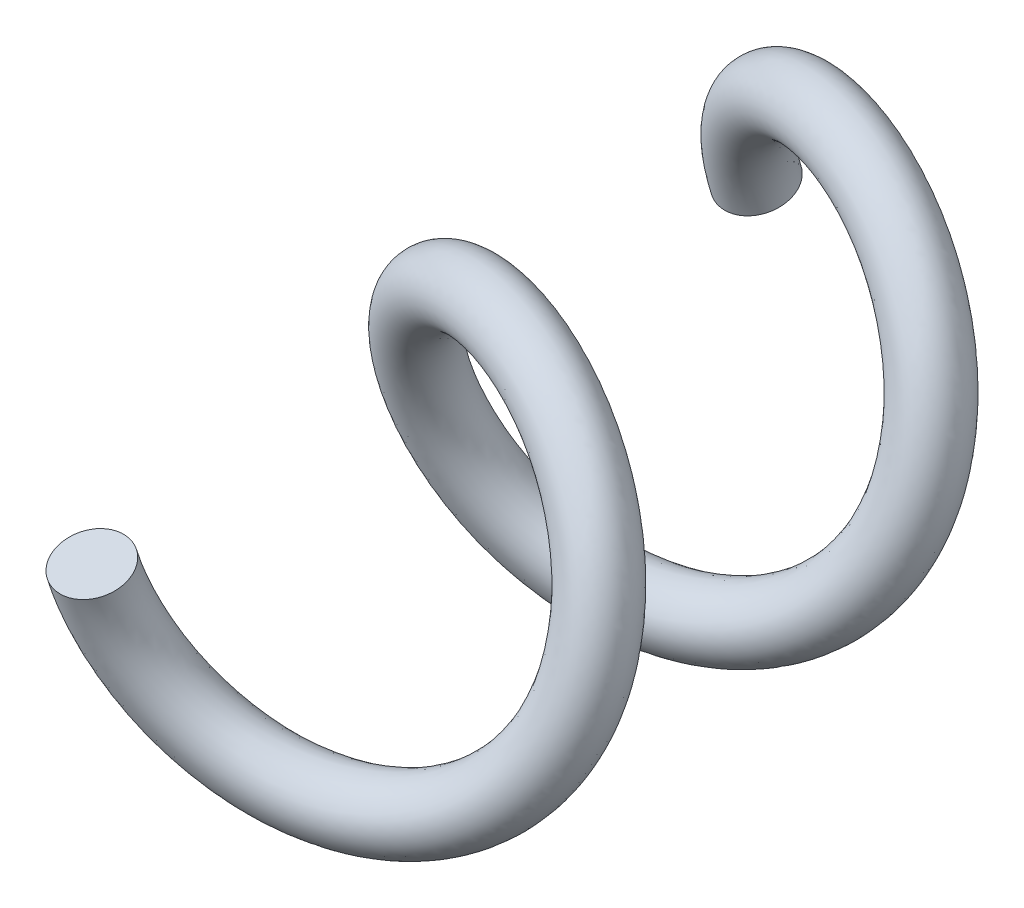
from build123d import *

# Parameters (mm, degrees)
SWEEP_2_PITCH       = 100
SWEEP_2_HEIGHT      = 200
SWEEP_2_RADIUS      = 50
SWEEP_2_START_ANGLE = -180
SKETCH_5_R          = 10


with BuildPart() as part:
    # 扫描2: sweep along a helix
    with BuildLine() as sweep_2_path:
        add(Helix(SWEEP_2_PITCH, SWEEP_2_HEIGHT, SWEEP_2_RADIUS, center=(0, 0, 0), direction=(0, 0, 1), lefthand=True, mode=Mode.PRIVATE).rotate(Axis((0, 0, 0), (0, 0, 1)), SWEEP_2_START_ANGLE))
    # 草图5 → 扫描2 (sweep)
    with BuildSketch(Plane(origin=(-50, 0, 0), x_dir=(1, 0, 0), z_dir=(-6.070289940851411e-15, 0.9528905139886877, 0.30331447105335213))):
        with Locations((-0.007172426, 0)):
            Circle(SKETCH_5_R)
    sweep(path=sweep_2_path.line, is_frenet=True)


solid = part.part
